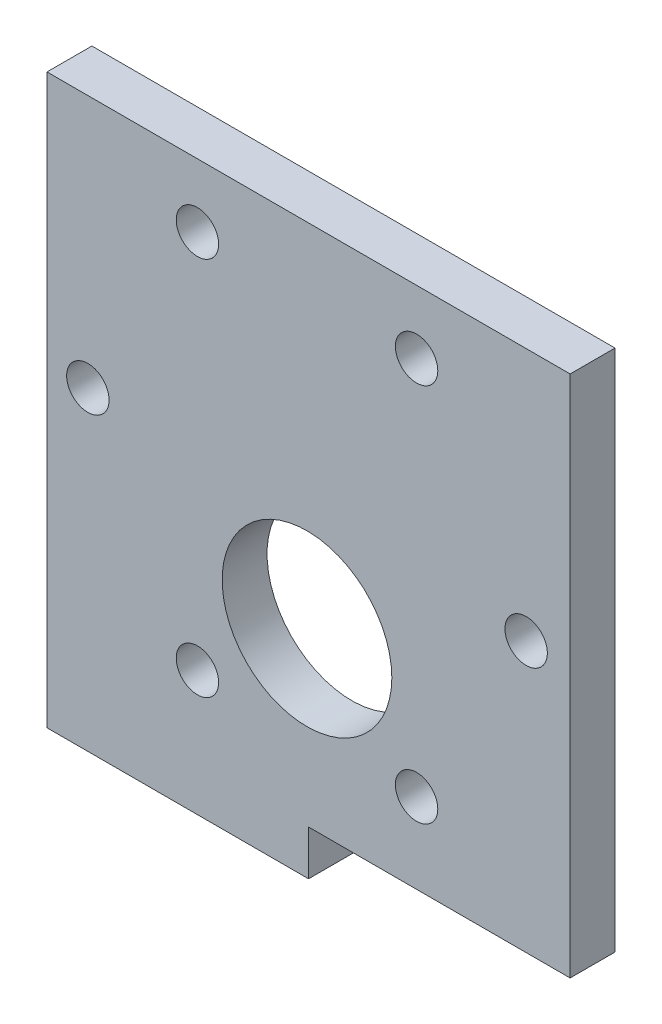
from build123d import *

# Parameters (mm, degrees)
SKETCH1_R           = 6
SKETCH1_R_2         = 1.5
BOSS_EXTRUDE1_DEPTH = 3.175


with BuildPart() as part:
    # Sketch1 → Boss-Extrude1 (new body)
    with BuildSketch(Plane.XY):
        Polygon((18.5, 0), (18.5, -3.175), (0, -3.175), (0, 0), (0, 37), (37, 37), (37, 0), align=None)
        with Locations((18.39023312, 12.089873912)):
            Circle(SKETCH1_R, mode=Mode.SUBTRACT)
        with Locations((2.89023312, 19.089873912)):
            Circle(SKETCH1_R_2, mode=Mode.SUBTRACT)
        with Locations((10.64023312, 5.666480153)):
            Circle(SKETCH1_R_2, mode=Mode.SUBTRACT)
        with Locations((26.14023312, 5.666480153)):
            Circle(SKETCH1_R_2, mode=Mode.SUBTRACT)
        with Locations((33.89023312, 19.089873912)):
            Circle(SKETCH1_R_2, mode=Mode.SUBTRACT)
        with Locations((26.14023312, 32.513267671)):
            Circle(SKETCH1_R_2, mode=Mode.SUBTRACT)
        with Locations((10.64023312, 32.513267671)):
            Circle(SKETCH1_R_2, mode=Mode.SUBTRACT)
    extrude(amount=BOSS_EXTRUDE1_DEPTH)


solid = part.part
